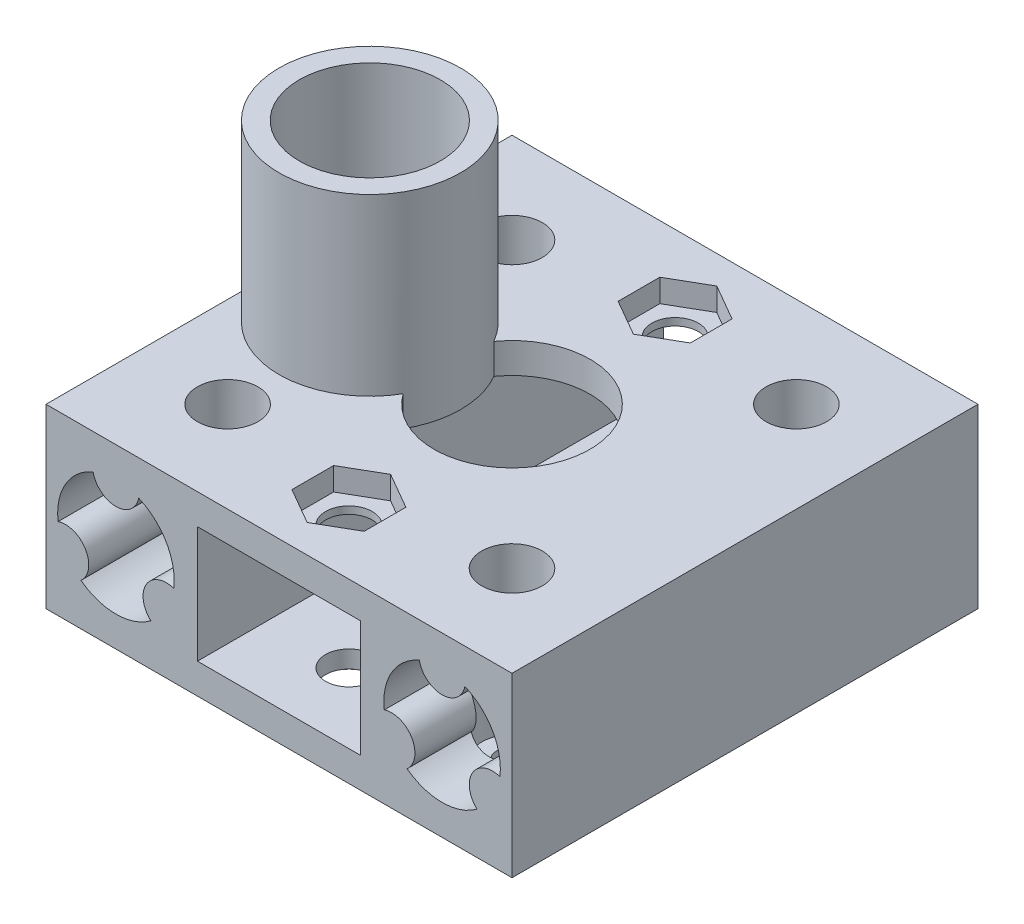
from build123d import *

# Parameters (mm, degrees)
SKETCH1_W           = 50.8
SKETCH1_H           = 19.304
BOSS_EXTRUDE1_DEPTH = 50.8
SKETCH1_3_R         = 6.35
CUT_EXTRUDE1_DEPTH  = 58.610425307
SKETCH1_4_R         = 2.54
BOSS_EXTRUDE2_DEPTH = 50.8
SKETCH2_R           = 11.049
CUT_EXTRUDE2_DEPTH  = 2.54
SKETCH2_3_R         = 8.509
SKETCH2_3_R_2       = 1.651
CUT_EXTRUDE3_DEPTH  = 60.987035399
SKETCH3_R           = 3.302
CUT_EXTRUDE4_DEPTH  = 18.034
SKETCH4_W           = 17.78
SKETCH4_H           = 12.7
CUT_EXTRUDE5_DEPTH  = 58.610425411
SKETCH5_R           = 2.54
CUT_EXTRUDE6_DEPTH  = 60.987035516
CUT_EXTRUDE7_DEPTH  = 2.5
SKETCH7_R           = 4.5
CUT_EXTRUDE8_DEPTH  = 1.397
SKETCH10_R          = 7.6835
BOSS_EXTRUDE3_DEPTH = 3.302
SKETCH10_3_R        = 9.9
BOSS_EXTRUDE4_DEPTH = 3.302
BOSS_EXTRUDE5_START = 19.05
SKETCH10_5_R        = 9.9
SKETCH10_5_R_2      = 7.6835
BOSS_EXTRUDE5_DEPTH = 19.05


with BuildPart() as part:
    # Sketch1 → Boss-Extrude1 (new body)
    with BuildSketch(Plane.XY):
        Rectangle(SKETCH1_W, SKETCH1_H)
    extrude(amount=BOSS_EXTRUDE1_DEPTH)

    # Sketch1<3> → Cut-Extrude1 (cut, through all)
    with BuildSketch(Plane.XY):
        with Locations((-17.78, 0)):
            Circle(SKETCH1_3_R)
        with Locations((17.78, 0)):
            Circle(SKETCH1_3_R)
    extrude(amount=CUT_EXTRUDE1_DEPTH, mode=Mode.SUBTRACT)

    # Sketch1<4> → Boss-Extrude2 (add)
    with BuildSketch(Plane.XY):
        with Locations((-17.78, 6.35)):
            Circle(SKETCH1_4_R)
        with Locations((17.78, 6.35)):
            Circle(SKETCH1_4_R)
        with Locations((-12.280738686, -3.175)):
            Circle(SKETCH1_4_R)
        with Locations((12.280738686, -3.175)):
            Circle(SKETCH1_4_R)
        with BuildLine():
            Line((-25.4, -1.777120382), (-25.4, -4.572879618))
            ThreePointArc((-25.4, -4.572879618), (-20.739261314, -3.175), (-25.4, -1.777120382))
        make_face()
        with BuildLine():
            Line((25.4, -1.777120382), (25.4, -4.572879618))
            ThreePointArc((25.4, -4.572879618), (20.739261314, -3.175), (25.4, -1.777120382))
        make_face()
    extrude(amount=BOSS_EXTRUDE2_DEPTH)

    # Sketch2 → Cut-Extrude2 (cut)
    with BuildSketch(Plane.XZ.offset(9.652)):
        with Locations((0, 25.4)):
            Circle(SKETCH2_R)
    extrude(amount=-CUT_EXTRUDE2_DEPTH, mode=Mode.SUBTRACT)

    # Sketch2<3> → Cut-Extrude3 (cut, through all)
    with BuildSketch(Plane.XZ.offset(9.652)):
        with Locations((0, 25.4)):
            Circle(SKETCH2_3_R)
        with Locations((-15.5, 40.9)):
            Circle(SKETCH2_3_R_2)
        with Locations((-15.5, 9.9)):
            Circle(SKETCH2_3_R_2)
        with Locations((15.5, 9.9)):
            Circle(SKETCH2_3_R_2)
        with Locations((15.5, 40.9)):
            Circle(SKETCH2_3_R_2)
    extrude(amount=-CUT_EXTRUDE3_DEPTH, mode=Mode.SUBTRACT)

    # Sketch3 → Cut-Extrude4 (cut)
    with BuildSketch(Plane(origin=(0, 9.652, 0), x_dir=(1, 0, 0), z_dir=(0, 1, 0))):
        with Locations(Location((-15.5, -9.9, 0), (0, 0, 62.298604086))):
            Circle(SKETCH3_R)
        with Locations(Location((15.5, -9.9, 0), (0, 0, 117.701509836))):
            Circle(SKETCH3_R)
        with Locations(Location((15.5, -40.9, 0), (0, 0, 117.701509836))):
            Circle(SKETCH3_R)
        with Locations(Location((-15.5, -40.9, 0), (0, 0, 62.298604086))):
            Circle(SKETCH3_R)
    extrude(amount=-CUT_EXTRUDE4_DEPTH, mode=Mode.SUBTRACT)

    # Sketch4 → Cut-Extrude5 (cut, through all)
    with BuildSketch(Plane(origin=(0, 0, 0), x_dir=(-1, 0, 0), z_dir=(0, 0, -1))):
        Rectangle(SKETCH4_W, SKETCH4_H)
    extrude(amount=-CUT_EXTRUDE5_DEPTH, mode=Mode.SUBTRACT)

    # Sketch5 → Cut-Extrude6 (cut, through all)
    with BuildSketch(Plane.XZ.offset(9.652)):
        with Locations((0, 43.18)):
            Circle(SKETCH5_R)
        with Locations((0, 7.62)):
            Circle(SKETCH5_R)
    extrude(amount=-CUT_EXTRUDE6_DEPTH, mode=Mode.SUBTRACT)

    # Sketch6 → Cut-Extrude7 (cut)
    with BuildSketch(Plane(origin=(0, 9.652, 0), x_dir=(1, 0, 0), z_dir=(0, 1, 0))):
        Polygon((0, -3.07394398), (-3.937, -5.34697199), (-3.937, -9.89302801), (0, -12.16605602), (3.937, -9.89302801), (3.937, -5.34697199), align=None)
        Polygon((0, -38.63394398), (-3.937, -40.90697199), (-3.937, -45.45302801), (0, -47.72605602), (3.937, -45.45302801), (3.937, -40.90697199), align=None)
    extrude(amount=-CUT_EXTRUDE7_DEPTH, mode=Mode.SUBTRACT)

    # Sketch7 → Cut-Extrude8 (cut)
    with BuildSketch(Plane.XZ.offset(9.652)):
        with Locations((0, 43.18)):
            Circle(SKETCH7_R)
        with Locations((0, 7.62)):
            Circle(SKETCH7_R)
    extrude(amount=-CUT_EXTRUDE8_DEPTH, mode=Mode.SUBTRACT)

    # Sketch10 → Boss-Extrude3 (add)
    with BuildSketch(Plane(origin=(0, 9.652, 0), x_dir=(1, 0, 0), z_dir=(0, 1, 0))):
        with Locations((-15.5, -25.4)):
            Circle(SKETCH10_R)
    extrude(amount=-BOSS_EXTRUDE3_DEPTH)

    # Sketch10<3> → Boss-Extrude4 (add)
    with BuildSketch(Plane(origin=(0, 9.652, 0), x_dir=(1, 0, 0), z_dir=(0, 1, 0))):
        with Locations((-15.5, -25.4)):
            Circle(SKETCH10_3_R)
    extrude(amount=-BOSS_EXTRUDE4_DEPTH)

    # Sketch10<5> → Boss-Extrude5 (add)
    with BuildSketch(Plane(origin=(0, 9.652, 0), x_dir=(1, 0, 0), z_dir=(0, 1, 0)).offset(BOSS_EXTRUDE5_START)):
        with Locations(Location((-15.5, -25.4, 0), (0, 0, 180))):
            Circle(SKETCH10_5_R)
        with Locations(Location((-15.5, -25.4, 0), (0, 0, 180))):
            Circle(SKETCH10_5_R_2, mode=Mode.SUBTRACT)
    extrude(amount=-BOSS_EXTRUDE5_DEPTH)


solid = part.part
